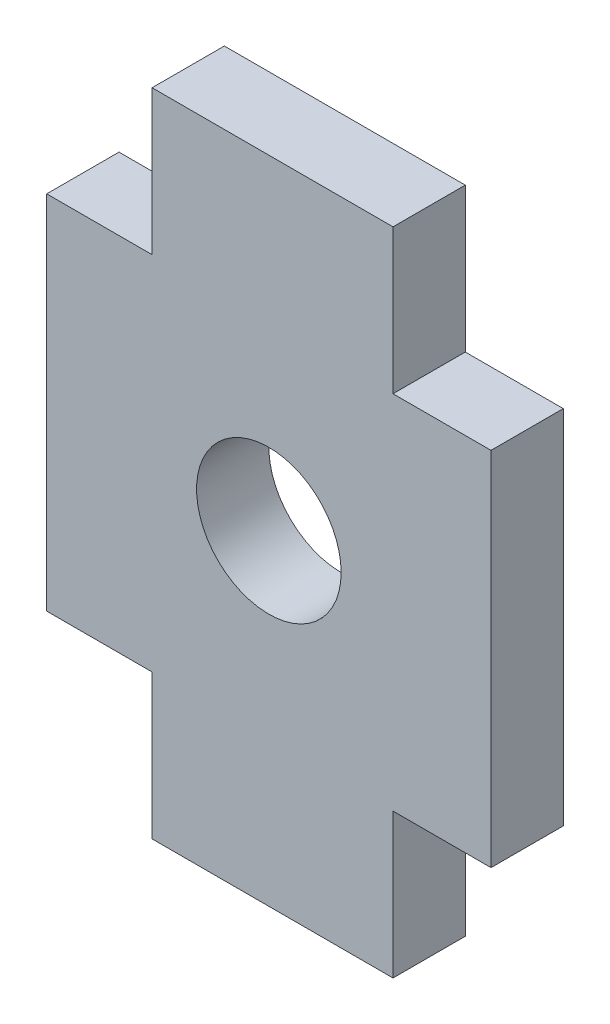
from build123d import *

# Parameters (mm, degrees)
SKETCH1_R           = 6
BOSS_EXTRUDE1_DEPTH = 6


with BuildPart() as part:
    # Sketch1 → Boss-Extrude1 (new body)
    with BuildSketch(Plane.XY):
        Polygon((-211.428617248, -75.762954902), (-211.428617248, -105.762954902), (-202.683627049, -105.762954902), (-202.683627049, -111.762954902), (-202.683627049, -117.762954902), (-182.683627049, -117.762954902), (-182.683627049, -111.762954902), (-182.683627049, -105.762954902), (-174.549373808, -105.762954902), (-174.549373808, -75.762954902), (-182.683627049, -75.762954902), (-182.683627049, -69.762954902), (-182.683627049, -63.762954902), (-202.683627049, -63.762954902), (-202.683627049, -69.762954902), (-202.683627049, -75.762954902), align=None)
        with Locations((-192.988995528, -90.762954902)):
            Circle(SKETCH1_R, mode=Mode.SUBTRACT)
    extrude(amount=BOSS_EXTRUDE1_DEPTH)


solid = part.part
